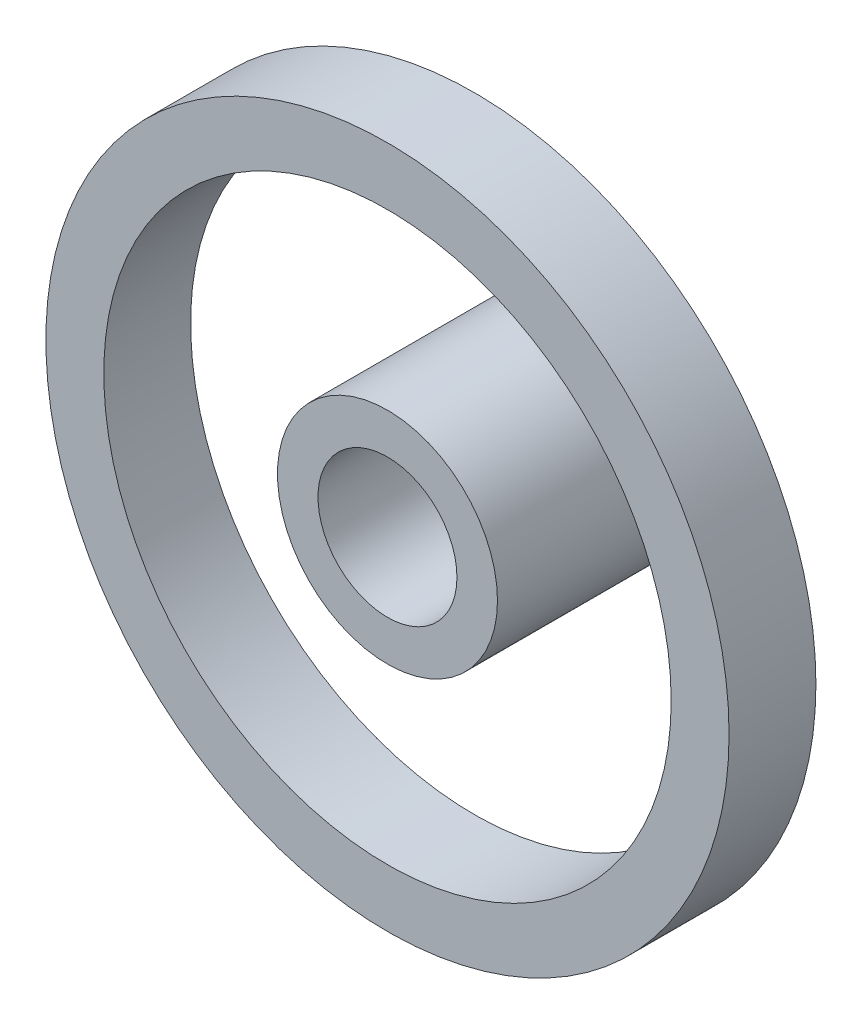
from build123d import *

# Parameters (mm, degrees)
SKETCH5_R           = 1.9
SKETCH5_R_2         = 1.2
BOSS_EXTRUDE3_DEPTH = 3.5
SKETCH9_R           = 5.9
SKETCH9_R_2         = 4.9
BOSS_EXTRUDE4_DEPTH = 1.5


with BuildPart() as part:
    # Sketch5 → Boss-Extrude3 (new body)
    with BuildSketch(Plane.XY):
        Circle(SKETCH5_R)
        Circle(SKETCH5_R_2, mode=Mode.SUBTRACT)
    extrude(amount=BOSS_EXTRUDE3_DEPTH)


with BuildPart() as body_2:
    # Sketch9 → Boss-Extrude4 (new body)
    with BuildSketch(Plane.XY.offset(3.5)):
        Circle(SKETCH9_R)
        Circle(SKETCH9_R_2, mode=Mode.SUBTRACT)
    extrude(amount=-BOSS_EXTRUDE4_DEPTH)


solid = Compound([part.part, body_2.part])
